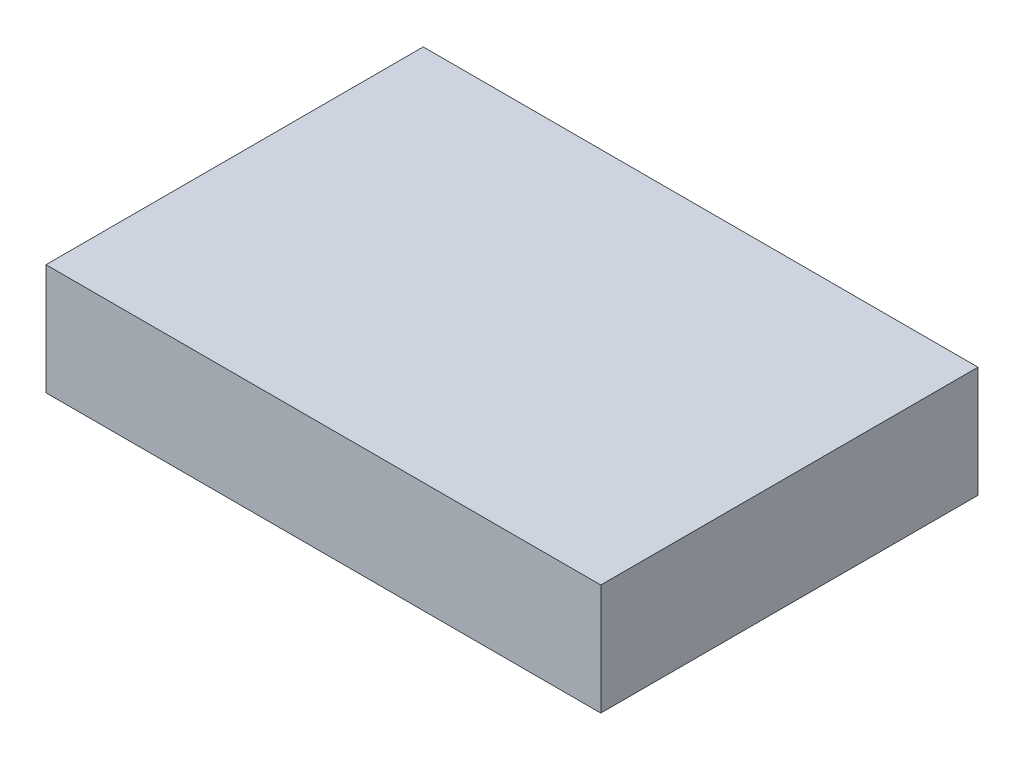
from build123d import *

# Parameters (mm, degrees)
SKETCH1_W           = 50
SKETCH1_H           = 34
BOSS_EXTRUDE1_DEPTH = 10


with BuildPart() as part:
    # Sketch1 → Boss-Extrude1 (new body)
    with BuildSketch(Plane(origin=(0, 0, 0), x_dir=(1, 0, 0), z_dir=(0, 1, 0))):
        Rectangle(SKETCH1_W, SKETCH1_H)
    extrude(amount=BOSS_EXTRUDE1_DEPTH)


solid = part.part
